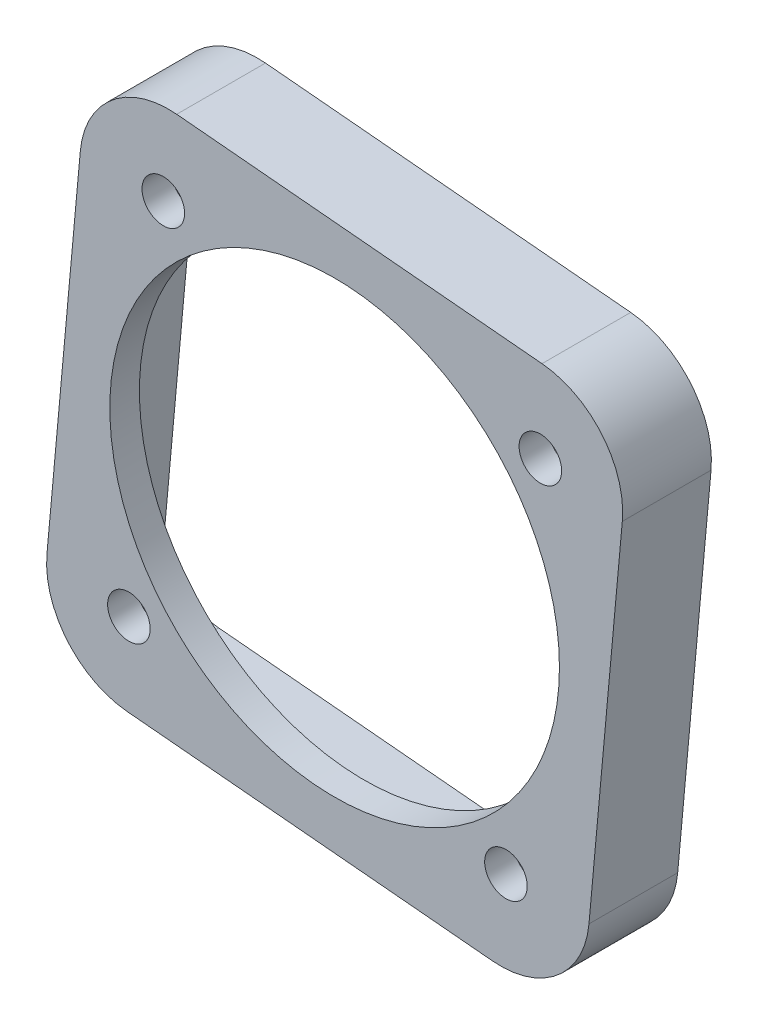
from build123d import *

# Parameters (mm, degrees)
BOSS_EXTRUDE2_DEPTH  = 2.5
BOSS_EXTRUDE3_START  = 5
BOSS_EXTRUDE3_DEPTH  = 5
M3_CLEARANCE_HOLE1_D = 3.6


with BuildPart() as part:
    # Sketch2 → Boss-Extrude2 (new body)
    # profile 1 of 3: a face of its own
    with BuildSketch(Plane.XY.offset(-2122.666602395)):
        with BuildLine():
            Line((135.41215099, 157.721273751), (166.283860401, 154.903906532))
            ThreePointArc((166.283860401, 154.903906532), (171.365571849, 152.234319322), (173.071201254, 146.753323477))
            Line((173.071201254, 146.753323477), (171.22628014, 126.537333121))
            Line((171.22628014, 126.537333121), (170.944543418, 123.45016218))
            Line((170.944543418, 123.45016218), (170.917278574, 123.151403701))
            Line((170.917278574, 123.151403701), (170.735512947, 121.159680514))
            Line((170.735512947, 121.159680514), (170.708248103, 120.860922035))
            Line((170.708248103, 120.860922035), (170.548948667, 119.115375386))
            Line((170.548948667, 119.115375386), (170.253834036, 115.881614066))
            ThreePointArc((170.253834036, 115.881614066), (167.584246825, 110.799902618), (162.10325098, 109.094273213))
            Line((162.10325098, 109.094273213), (131.231541569, 111.911640431))
            ThreePointArc((131.231541569, 111.911640431), (126.149830121, 114.581227642), (124.444200716, 120.062223487))
            Line((124.444200716, 120.062223487), (127.261567935, 150.933932898))
            ThreePointArc((127.261567935, 150.933932898), (129.931155146, 156.015644346), (135.41215099, 157.721273751))
        make_face()
        with BuildLine():
            ThreePointArc((170.581547269, 146.980530511), (169.444460999, 150.63452774), (166.056653367, 152.414252548))
            Line((166.056653367, 152.414252548), (135.184943956, 155.231619766))
            ThreePointArc((135.184943956, 155.231619766), (131.530946727, 154.094533496), (129.751221919, 150.706725864))
            Line((129.751221919, 150.706725864), (126.933854701, 119.835016453))
            ThreePointArc((126.933854701, 119.835016453), (128.070940971, 116.181019223), (131.458748603, 114.401294416))
            Line((131.458748603, 114.401294416), (162.330458014, 111.583927198))
            ThreePointArc((162.330458014, 111.583927198), (165.984455244, 112.721013468), (167.764180051, 116.1088211))
            Line((167.764180051, 116.1088211), (168.059294682, 119.34258242))
            Line((168.059294682, 119.34258242), (168.218594119, 121.088129069))
            Line((168.218594119, 121.088129069), (168.245858963, 121.386887547))
            Line((168.245858963, 121.386887547), (168.42762459, 123.378610735))
            Line((168.42762459, 123.378610735), (168.454889434, 123.677369213))
            Line((168.454889434, 123.677369213), (168.736626156, 126.764540154))
            Line((168.736626156, 126.764540154), (170.581547269, 146.980530511))
        make_face(mode=Mode.SUBTRACT)
    # profile 2 of 3: a face of its own
    with BuildSketch(Plane.XY.offset(-2122.666602395)):
        with BuildLine():
            Line((170.581547269, 146.980530511), (168.736626156, 126.764540154))
            Line((168.736626156, 126.764540154), (168.454889434, 123.677369213))
            Line((168.454889434, 123.677369213), (168.42762459, 123.378610735))
            Line((168.42762459, 123.378610735), (168.245858963, 121.386887547))
            Line((168.245858963, 121.386887547), (168.218594119, 121.088129069))
            Line((168.218594119, 121.088129069), (168.059294682, 119.34258242))
            Line((168.059294682, 119.34258242), (167.764180051, 116.1088211))
            ThreePointArc((167.764180051, 116.1088211), (165.984455244, 112.721013468), (162.330458014, 111.583927198))
            Line((162.330458014, 111.583927198), (131.458748603, 114.401294416))
            ThreePointArc((131.458748603, 114.401294416), (128.070940971, 116.181019223), (126.933854701, 119.835016453))
            Line((126.933854701, 119.835016453), (129.751221919, 150.706725864))
            ThreePointArc((129.751221919, 150.706725864), (131.530946727, 154.094533496), (135.184943956, 155.231619766))
            Line((135.184943956, 155.231619766), (166.056653367, 152.414252548))
            ThreePointArc((166.056653367, 152.414252548), (169.444460999, 150.63452774), (170.581547269, 146.980530511))
        make_face()
        with BuildLine():
            ThreePointArc((170.332581871, 147.003251214), (169.252349914, 150.474548582), (166.033932664, 152.165287149))
            Line((166.033932664, 152.165287149), (135.162223253, 154.982654367))
            ThreePointArc((135.162223253, 154.982654367), (131.690925885, 153.902422411), (130.000187318, 150.684005161))
            Line((130.000187318, 150.684005161), (127.1828201, 119.81229575))
            ThreePointArc((127.1828201, 119.81229575), (128.263052056, 116.340998381), (131.481469307, 114.650259814))
            Line((131.481469307, 114.650259814), (162.353178718, 111.832892596))
            ThreePointArc((162.353178718, 111.832892596), (165.824476086, 112.913124553), (167.515214653, 116.131541803))
            Line((167.515214653, 116.131541803), (167.810329284, 119.365303123))
            Line((167.810329284, 119.365303123), (167.96962872, 121.110849773))
            Line((167.96962872, 121.110849773), (167.996893564, 121.409608251))
            Line((167.996893564, 121.409608251), (168.178659191, 123.401331438))
            Line((168.178659191, 123.401331438), (168.205924035, 123.700089917))
            Line((168.205924035, 123.700089917), (168.487660757, 126.787260858))
            Line((168.487660757, 126.787260858), (170.332581871, 147.003251214))
        make_face(mode=Mode.SUBTRACT)
    # profile 3 of 3: a face of its own
    with BuildSketch(Plane.XY.offset(-2122.666602395)):
        with BuildLine():
            Line((130.000187318, 150.684005161), (127.1828201, 119.81229575))
            ThreePointArc((127.1828201, 119.81229575), (128.263052056, 116.340998381), (131.481469307, 114.650259814))
            Line((131.481469307, 114.650259814), (162.353178718, 111.832892596))
            ThreePointArc((162.353178718, 111.832892596), (165.824476086, 112.913124553), (167.515214653, 116.131541803))
            Line((167.515214653, 116.131541803), (167.810329284, 119.365303123))
            Line((167.810329284, 119.365303123), (167.96962872, 121.110849773))
            Line((167.96962872, 121.110849773), (167.996893564, 121.409608251))
            Line((167.996893564, 121.409608251), (168.178659191, 123.401331438))
            Line((168.178659191, 123.401331438), (168.205924035, 123.700089917))
            Line((168.205924035, 123.700089917), (168.487660757, 126.787260858))
            Line((168.487660757, 126.787260858), (170.332581871, 147.003251214))
            ThreePointArc((170.332581871, 147.003251214), (169.252349914, 150.474548582), (166.033932664, 152.165287149))
            Line((166.033932664, 152.165287149), (135.162223253, 154.982654367))
            ThreePointArc((135.162223253, 154.982654367), (131.690925885, 153.902422411), (130.000187318, 150.684005161))
        make_face()
        with BuildLine():
            ThreePointArc((129.758780791, 133.610335718), (129.767141126, 134.006635943), (129.783767025, 134.402675515))
            ThreePointArc((129.783767025, 134.402675515), (130.33124015, 138.04086544), (131.56963679, 141.505331708))
            ThreePointArc((131.56963679, 141.505331708), (133.915565147, 145.269940389), (137.070437532, 148.388022911))
            ThreePointArc((137.070437532, 148.388022911), (157.092627331, 150.481993898), (167.757700985, 133.407773482))
            ThreePointArc((167.757700985, 133.407773482), (153.064517377, 114.902332861), (131.710192294, 125.018348745))
            ThreePointArc((131.710192294, 125.018348745), (130.229565113, 129.199664511), (129.758780791, 133.610335718))
        make_face(mode=Mode.SUBTRACT)
    extrude(amount=BOSS_EXTRUDE2_DEPTH)

    # Sketch4 → Boss-Extrude3 (add)
    with BuildSketch(Plane(origin=(0, 0, -2122.666602395), x_dir=(-1, 0, 0), z_dir=(0, 0, -1)).offset(BOSS_EXTRUDE3_START)):
        with BuildLine():
            Line((-135.41215099, 157.721273751), (-166.283860401, 154.903906532))
            ThreePointArc((-166.283860401, 154.903906532), (-171.365571849, 152.234319322), (-173.071201254, 146.753323477))
            Line((-173.071201254, 146.753323477), (-170.253834036, 115.881614066))
            ThreePointArc((-170.253834036, 115.881614066), (-167.584246825, 110.799902618), (-162.10325098, 109.094273213))
            Line((-162.10325098, 109.094273213), (-131.231541569, 111.911640431))
            ThreePointArc((-131.231541569, 111.911640431), (-126.149830121, 114.581227642), (-124.444200716, 120.062223487))
            Line((-124.444200716, 120.062223487), (-127.261567935, 150.933932898))
            ThreePointArc((-127.261567935, 150.933932898), (-129.931155146, 156.015644346), (-135.41215099, 157.721273751))
        make_face()
        with BuildLine():
            Line((-135.184943956, 155.231619766), (-166.056653367, 152.414252548))
            ThreePointArc((-166.056653367, 152.414252548), (-169.444460999, 150.63452774), (-170.581547269, 146.980530511))
            Line((-170.581547269, 146.980530511), (-167.764180051, 116.1088211))
            ThreePointArc((-167.764180051, 116.1088211), (-165.984455244, 112.721013468), (-162.330458014, 111.583927198))
            Line((-162.330458014, 111.583927198), (-131.458748603, 114.401294416))
            ThreePointArc((-131.458748603, 114.401294416), (-128.070940971, 116.181019223), (-126.933854701, 119.835016453))
            Line((-126.933854701, 119.835016453), (-129.751221919, 150.706725864))
            ThreePointArc((-129.751221919, 150.706725864), (-131.530946727, 154.094533496), (-135.184943956, 155.231619766))
        make_face(mode=Mode.SUBTRACT)
    extrude(amount=-BOSS_EXTRUDE3_DEPTH)

    # M3 Clearance Hole1 (through all)
    with Locations(Plane.XY.offset(-2120.166602395)):
        with Locations((134.278040499, 150.795684), (131.369790467, 118.928112995), (163.237361472, 116.019862963), (166.145611504, 147.887433968)):
            Hole(M3_CLEARANCE_HOLE1_D / 2)


solid = part.part
